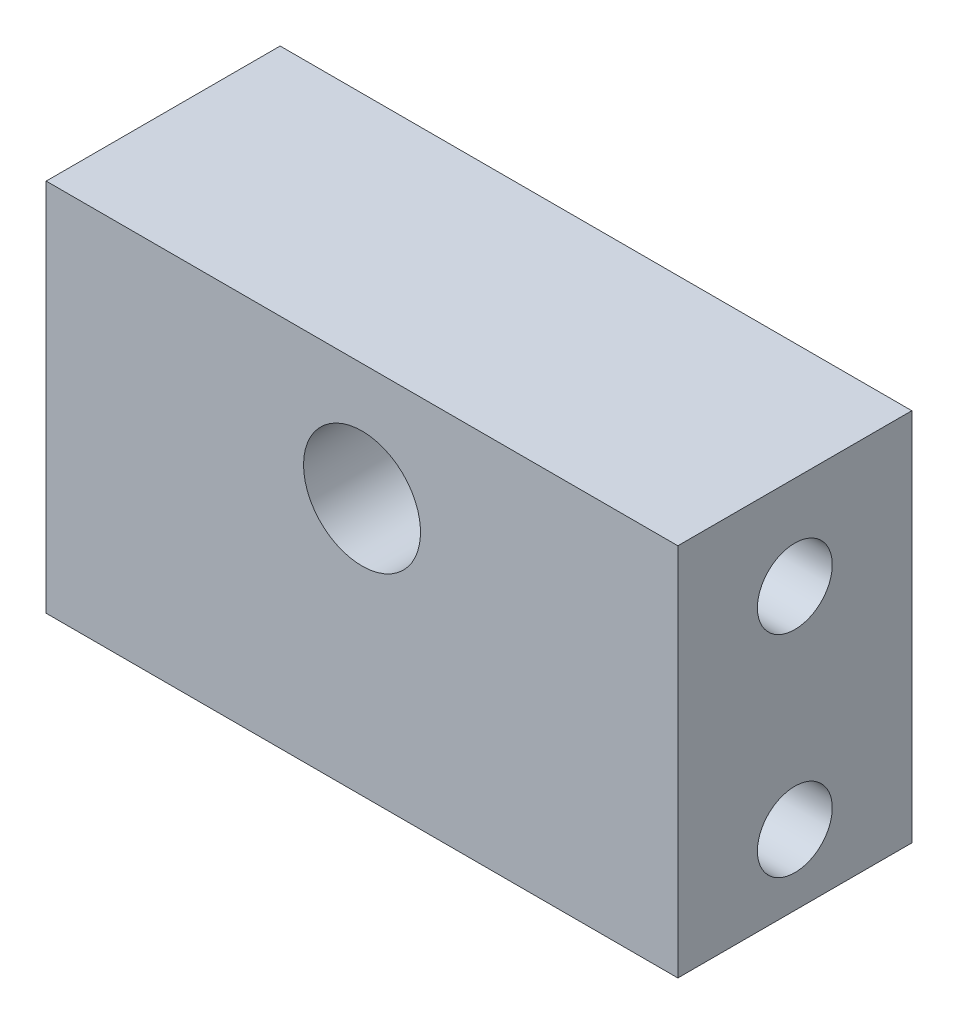
from build123d import *

# Parameters (mm, degrees)
ESQUISSE1_W                               = 13.5
ESQUISSE1_H                               = 8
BOSS_EXTRU_1_DEPTH                        = 5
TROU_POUR_TARAUDAGE_POUR_TROU_TARAUD_M2_D = 1.6
KERNLOCH_F_R_M3_GEWINDE1_D                = 2.5
KERNLOCH_F_R_M3_GEWINDE1_DEPTH            = 5
KERNLOCH_F_R_M3_GEWINDE1_TIP              = 0.751075774


with BuildPart() as part:
    # Esquisse1 → Boss.-Extru.1 (new body)
    with BuildSketch(Plane.XY):
        with Locations((6.75, 4)):
            Rectangle(ESQUISSE1_W, ESQUISSE1_H)
    extrude(amount=BOSS_EXTRU_1_DEPTH)

    # Trou pour taraudage pour trou taraudé M21 (through all)
    with Locations(Plane.ZY):
        with Locations((2.5, 6), (2.5, 1.5)):
            Hole(TROU_POUR_TARAUDAGE_POUR_TROU_TARAUD_M2_D / 2)

    # Kernloch für M3 Gewinde1
    with Locations(Plane(origin=(0, 0, 0), x_dir=(-1, 0, 0), z_dir=(0, 0, -1))):
        with Locations((-6.75, 5.5)):
            Hole(KERNLOCH_F_R_M3_GEWINDE1_D / 2, depth=KERNLOCH_F_R_M3_GEWINDE1_DEPTH)
            with Locations((0, 0, -(KERNLOCH_F_R_M3_GEWINDE1_DEPTH + KERNLOCH_F_R_M3_GEWINDE1_TIP / 2))):  # 118° drill point
                Cone(0, KERNLOCH_F_R_M3_GEWINDE1_D / 2, KERNLOCH_F_R_M3_GEWINDE1_TIP, mode=Mode.SUBTRACT)


solid = part.part
